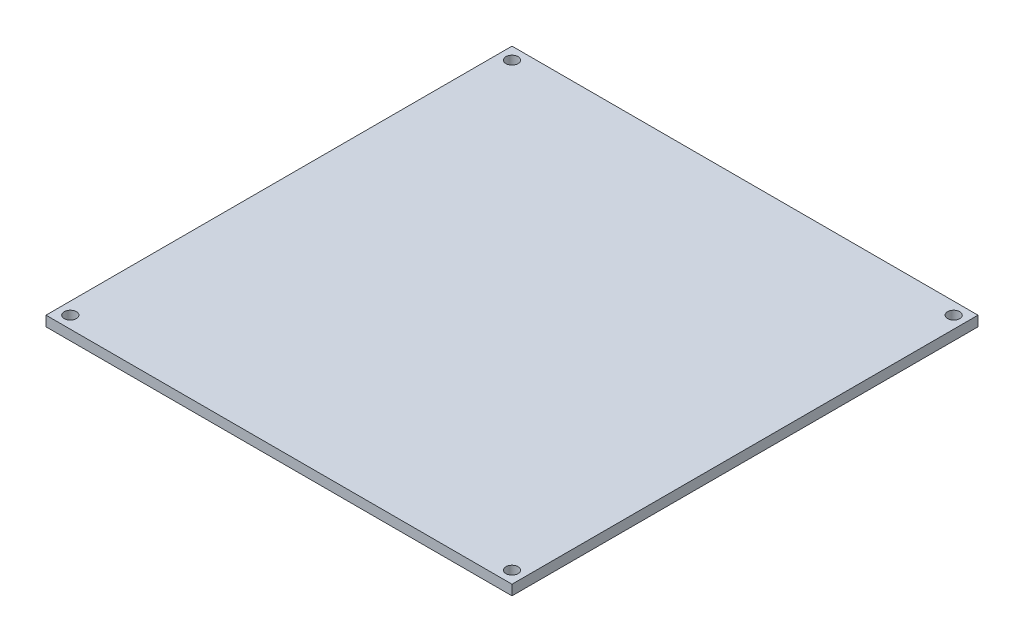
from build123d import *

# Parameters (mm, degrees)
SKETCH2_W           = 230
SKETCH2_H           = 230
BOSS_EXTRUDE1_DEPTH = 5
SKETCH3_R           = 3
CUT_EXTRUDE1_DEPTH  = 326.307546792
SKETCH4_R           = 3
CUT_EXTRUDE2_DEPTH  = 326.307546792
SKETCH5_R           = 3
CUT_EXTRUDE3_DEPTH  = 326.307546792
SKETCH6_R           = 3
CUT_EXTRUDE4_DEPTH  = 326.307546792


with BuildPart() as part:
    # Sketch2 → Boss-Extrude1 (new body)
    with BuildSketch(Plane(origin=(0, 0, 0), x_dir=(1, 0, 0), z_dir=(0, 1, 0))):
        with Locations((115, 115)):
            Rectangle(SKETCH2_W, SKETCH2_H)
    extrude(amount=BOSS_EXTRUDE1_DEPTH)

    # Sketch3 → Cut-Extrude1 (cut, through all)
    with BuildSketch(Plane(origin=(0, 5, 0), x_dir=(1, 0, 0), z_dir=(0, 1, 0))):
        with Locations(Location((6, 224, 0), (0, 0, 270))):
            Circle(SKETCH3_R)
    extrude(amount=-CUT_EXTRUDE1_DEPTH, mode=Mode.SUBTRACT)

    # Sketch4 → Cut-Extrude2 (cut, through all)
    with BuildSketch(Plane(origin=(0, 5, 0), x_dir=(1, 0, 0), z_dir=(0, 1, 0))):
        with Locations(Location((224, 224, 0), (0, 0, 270))):
            Circle(SKETCH4_R)
    extrude(amount=-CUT_EXTRUDE2_DEPTH, mode=Mode.SUBTRACT)

    # Sketch5 → Cut-Extrude3 (cut, through all)
    with BuildSketch(Plane(origin=(0, 5, 0), x_dir=(1, 0, 0), z_dir=(0, 1, 0))):
        with Locations(Location((6, 6, 0), (0, 0, 270))):
            Circle(SKETCH5_R)
    extrude(amount=-CUT_EXTRUDE3_DEPTH, mode=Mode.SUBTRACT)

    # Sketch6 → Cut-Extrude4 (cut, through all)
    with BuildSketch(Plane(origin=(0, 5, 0), x_dir=(1, 0, 0), z_dir=(0, 1, 0))):
        with Locations(Location((224, 6, 0), (0, 0, 270))):
            Circle(SKETCH6_R)
    extrude(amount=-CUT_EXTRUDE4_DEPTH, mode=Mode.SUBTRACT)


solid = part.part
